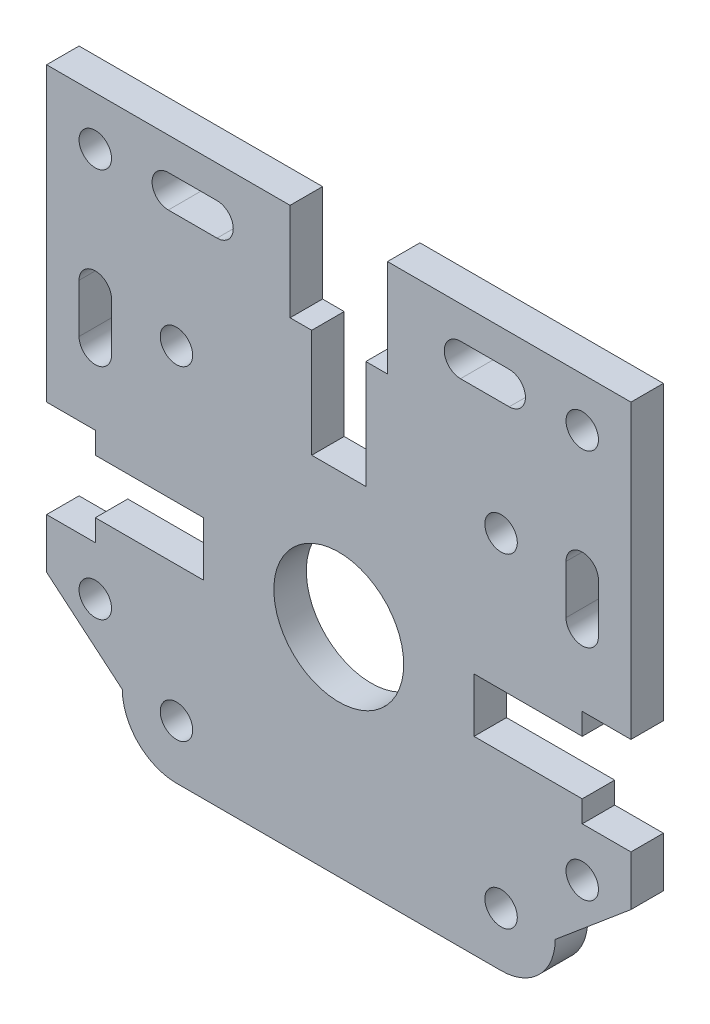
from build123d import *

# Parameters (mm, degrees)
MODEL_R                 = 1.5
MODEL_R_2               = 6
SALIENTE_EXTRUIR1_DEPTH = 3


with BuildPart() as part:
    # Model → Saliente-Extruir1 (new body)
    with BuildSketch(Plane.XY):
        with BuildLine():
            Line((187.952926253, 215.611282897), (189.952926253, 215.611282897))
            Line((189.952926253, 215.611282897), (189.952926253, 224.611282897))
            Line((189.952926253, 224.611282897), (212.452926253, 224.611282897))
            Line((212.452926253, 224.611282897), (212.452926253, 197.611282897))
            Line((212.452926253, 197.611282897), (207.952926253, 197.611282897))
            Line((207.952926253, 197.611282897), (207.952926253, 195.611282897))
            Line((207.952926253, 195.611282897), (197.952926253, 195.611282897))
            Line((197.952926253, 195.611282897), (197.952926253, 190.611282897))
            Line((197.952926253, 190.611282897), (207.952926253, 190.611282897))
            Line((207.952926253, 190.611282897), (207.952926253, 188.611282897))
            Line((207.952926253, 188.611282897), (212.452926253, 188.611282897))
            Line((212.452926253, 188.611282897), (212.452926253, 183.995647927))
            Line((212.452926253, 183.995647927), (205.452926253, 178.111282897))
            ThreePointArc((205.452926253, 178.111282897), (203.988460159, 174.575748991), (200.452926253, 173.111282897))
            Line((200.452926253, 173.111282897), (170.452926253, 173.111282897))
            ThreePointArc((170.452926253, 173.111282897), (166.917392347, 174.575748991), (165.452926253, 178.111282897))
            Line((165.452926253, 178.111282897), (158.452926253, 183.995647927))
            Line((158.452926253, 183.995647927), (158.452926253, 188.611282897))
            Line((158.452926253, 188.611282897), (162.952926253, 188.611282897))
            Line((162.952926253, 188.611282897), (162.952926253, 190.611282897))
            Line((162.952926253, 190.611282897), (172.952926253, 190.611282897))
            Line((172.952926253, 190.611282897), (172.952926253, 195.611282897))
            Line((172.952926253, 195.611282897), (162.952926253, 195.611282897))
            Line((162.952926253, 195.611282897), (162.952926253, 197.611282897))
            Line((162.952926253, 197.611282897), (158.452926253, 197.611282897))
            Line((158.452926253, 197.611282897), (158.452926253, 224.611282897))
            Line((158.452926253, 224.611282897), (180.952926253, 224.611282897))
            Line((180.952926253, 224.611282897), (180.952926253, 215.611282897))
            Line((180.952926253, 215.611282897), (182.952926253, 215.611282897))
            Line((182.952926253, 215.611282897), (182.952926253, 205.611282897))
            Line((182.952926253, 205.611282897), (187.952926253, 205.611282897))
            Line((187.952926253, 205.611282897), (187.952926253, 215.611282897))
        make_face()
        with Locations((207.952926253, 220.111282897)):
            Circle(MODEL_R, mode=Mode.SUBTRACT)
        with Locations((200.452926253, 208.111282897)):
            Circle(MODEL_R, mode=Mode.SUBTRACT)
        with Locations((207.952926253, 184.111282897)):
            Circle(MODEL_R, mode=Mode.SUBTRACT)
        with Locations((185.452926253, 193.111282897)):
            Circle(MODEL_R_2, mode=Mode.SUBTRACT)
        with Locations((200.452926253, 178.111282897)):
            Circle(MODEL_R, mode=Mode.SUBTRACT)
        with Locations((162.952926253, 220.111282897)):
            Circle(MODEL_R, mode=Mode.SUBTRACT)
        with Locations((170.452926253, 208.111282897)):
            Circle(MODEL_R, mode=Mode.SUBTRACT)
        with Locations((162.952926253, 184.111282897)):
            Circle(MODEL_R, mode=Mode.SUBTRACT)
        with Locations((170.452926253, 178.111282897)):
            Circle(MODEL_R, mode=Mode.SUBTRACT)
        with BuildLine():
            Line((169.702926253, 221.611282897), (174.202926253, 221.611282897))
            ThreePointArc((174.202926253, 221.611282897), (175.702926253, 220.111282897), (174.202926253, 218.611282897))
            Line((174.202926253, 218.611282897), (169.702926253, 218.611282897))
            ThreePointArc((169.702926253, 218.611282897), (168.202926253, 220.111282897), (169.702926253, 221.611282897))
        make_face(mode=Mode.SUBTRACT)
        with BuildLine():
            Line((164.452926253, 208.861282897), (164.452926253, 204.361282897))
            ThreePointArc((164.452926253, 204.361282897), (162.952926253, 202.861282897), (161.452926253, 204.361282897))
            Line((161.452926253, 204.361282897), (161.452926253, 208.861282897))
            ThreePointArc((161.452926253, 208.861282897), (162.952926253, 210.361282897), (164.452926253, 208.861282897))
        make_face(mode=Mode.SUBTRACT)
        with BuildLine():
            Line((196.702926253, 218.611282897), (201.202926253, 218.611282897))
            ThreePointArc((201.202926253, 218.611282897), (202.702926253, 220.111282897), (201.202926253, 221.611282897))
            Line((201.202926253, 221.611282897), (196.702926253, 221.611282897))
            ThreePointArc((196.702926253, 221.611282897), (195.202926253, 220.111282897), (196.702926253, 218.611282897))
        make_face(mode=Mode.SUBTRACT)
        with BuildLine():
            Line((206.452926253, 208.861282897), (206.452926253, 204.361282897))
            ThreePointArc((206.452926253, 204.361282897), (207.952926253, 202.861282897), (209.452926253, 204.361282897))
            Line((209.452926253, 204.361282897), (209.452926253, 208.861282897))
            ThreePointArc((209.452926253, 208.861282897), (207.952926253, 210.361282897), (206.452926253, 208.861282897))
        make_face(mode=Mode.SUBTRACT)
    extrude(amount=SALIENTE_EXTRUIR1_DEPTH)


solid = part.part
